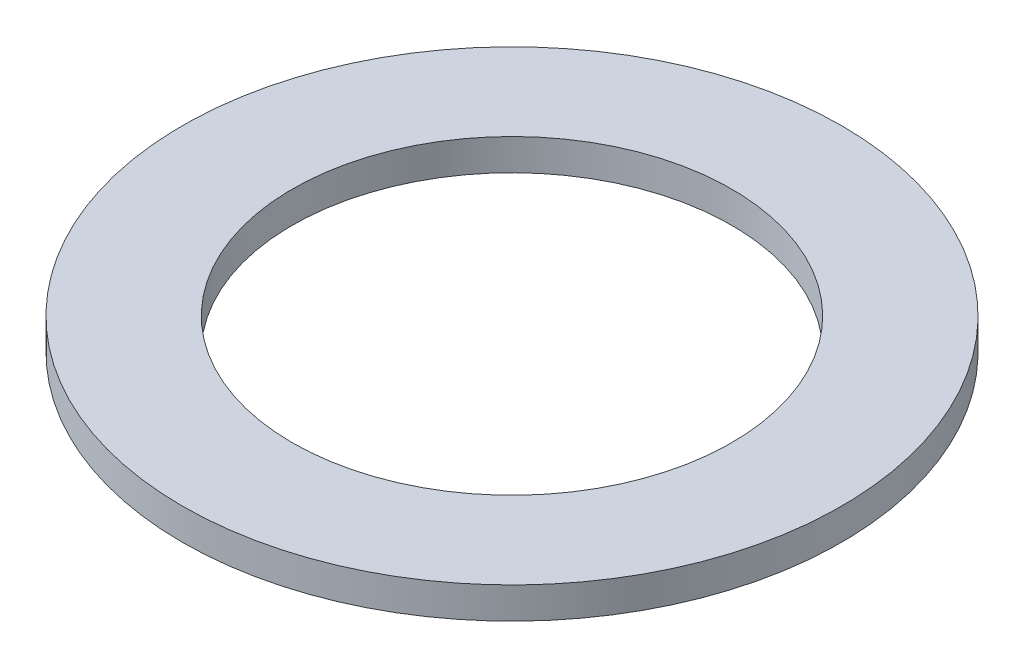
from build123d import *

# Parameters (mm, degrees)
SKETCH_1_R      = 10.5
SKETCH_1_R_2    = 7
EXTRUDE_1_DEPTH = 1


with BuildPart() as part:
    # 草图1 → 凸台-拉伸1 (new body)
    with BuildSketch(Plane(origin=(0, 0, 0), x_dir=(1, 0, 0), z_dir=(0, 1, 0))):
        with Locations(Location((0, 0, 0), (0, 0, 270))):
            Circle(SKETCH_1_R)
        with Locations(Location((0, 0, 0), (0, 0, 270))):
            Circle(SKETCH_1_R_2, mode=Mode.SUBTRACT)
    extrude(amount=EXTRUDE_1_DEPTH)


solid = part.part
